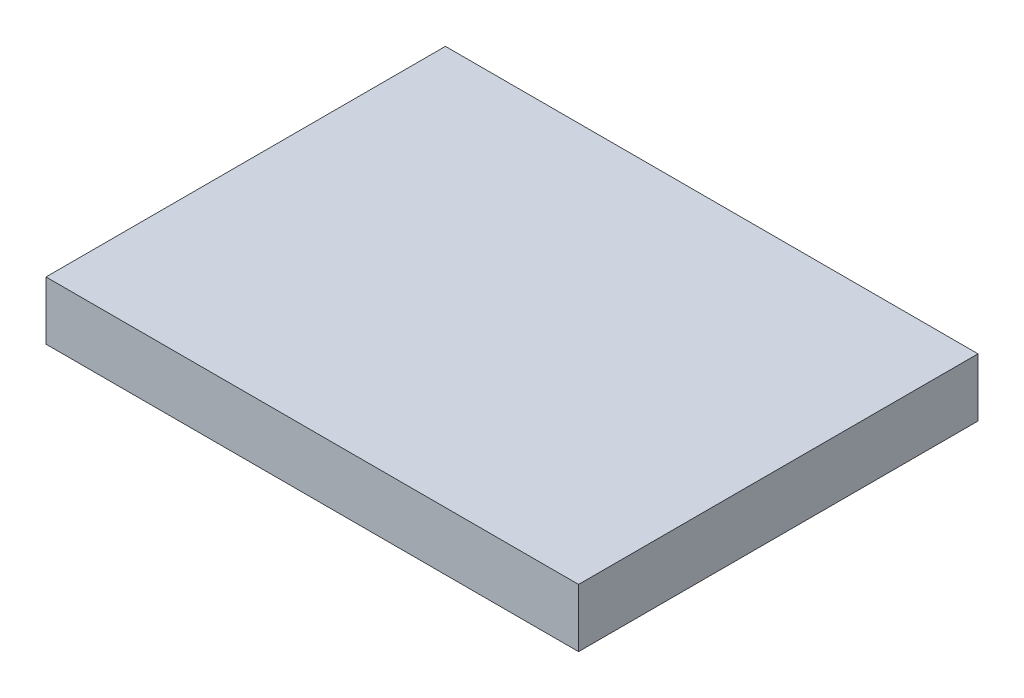
from build123d import *

# Parameters (mm, degrees)
SKETCH1_W           = 91.44
SKETCH1_H           = 68.58
BOSS_EXTRUDE1_DEPTH = 10


with BuildPart() as part:
    # Sketch1 → Boss-Extrude1 (new body)
    with BuildSketch(Plane(origin=(0, 0, 0), x_dir=(1, 0, 0), z_dir=(0, 1, 0))):
        Rectangle(SKETCH1_W, SKETCH1_H)
    extrude(amount=BOSS_EXTRUDE1_DEPTH)


solid = part.part
